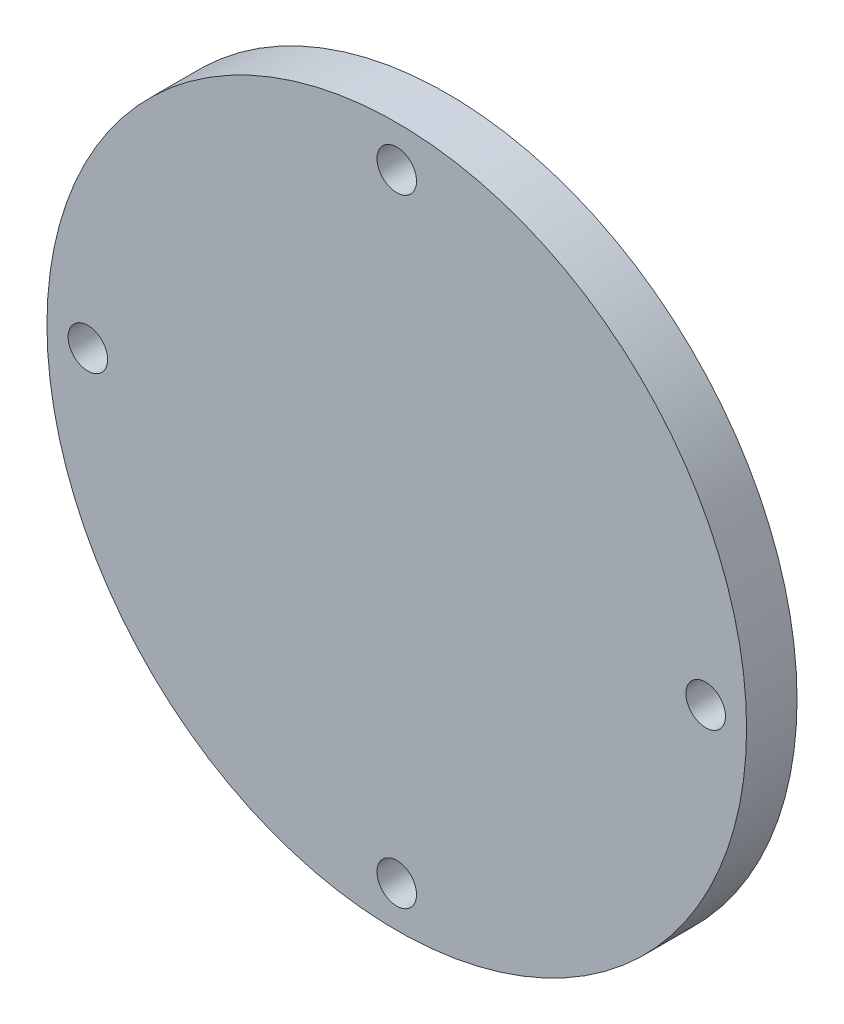
from build123d import *

# Parameters (mm, degrees)
SKETCH1_R           = 25.65
SKETCH1_R_2         = 1.45
BOSS_EXTRUDE1_DEPTH = 3.7


with BuildPart() as part:
    # Sketch1 → Boss-Extrude1 (new body)
    with BuildSketch(Plane.XY):
        Circle(SKETCH1_R)
        with Locations((0, -22.65)):
            Circle(SKETCH1_R_2, mode=Mode.SUBTRACT)
        with Locations((22.65, 0)):
            Circle(SKETCH1_R_2, mode=Mode.SUBTRACT)
        with Locations((0, 22.65)):
            Circle(SKETCH1_R_2, mode=Mode.SUBTRACT)
        with Locations((-22.65, 0)):
            Circle(SKETCH1_R_2, mode=Mode.SUBTRACT)
    extrude(amount=BOSS_EXTRUDE1_DEPTH)


solid = part.part
